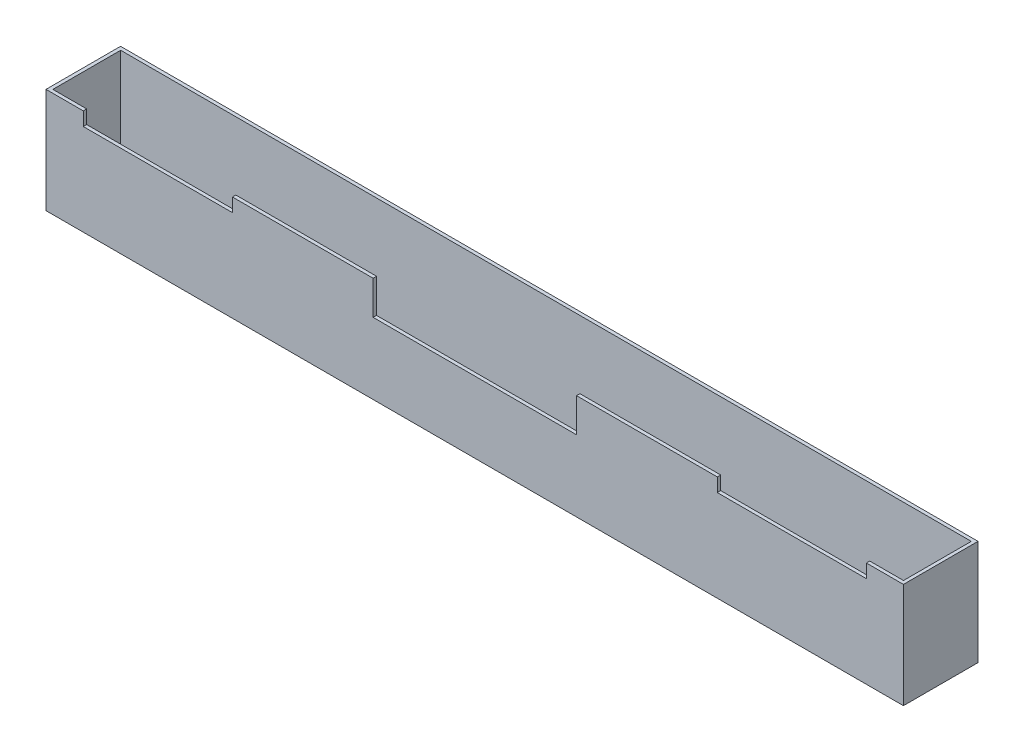
from build123d import *

# Parameters (mm, degrees)
BOSS_EXTRUDE1_DEPTH = 69.85
SKETCH3_W           = 796.798
SKETCH3_H           = 63.5
CUT_EXTRUDE1_DEPTH  = 95.25
CUT_EXTRUDE3_DEPTH  = 3.175


with BuildPart() as part:
    # Sketch2 → Boss-Extrude1 (new body)
    with BuildSketch(Plane.XY):
        Polygon((90.424, 0), (357.124, 0), (401.447, 0), (401.447, 98.425), (-401.701, 98.425), (-401.701, 0), (-366.776, 0), (-227.076, 0), (-100.076, 0), align=None)
    extrude(amount=BOSS_EXTRUDE1_DEPTH)

    # Sketch3 → Cut-Extrude1 (cut)
    with BuildSketch(Plane(origin=(0, 98.425, 0), x_dir=(1, 0, 0), z_dir=(0, 1, 0))):
        with Locations((-0.0635, -34.925)):
            Rectangle(SKETCH3_W, SKETCH3_H)
    extrude(amount=-CUT_EXTRUDE1_DEPTH, mode=Mode.SUBTRACT)

    # Sketch4 → Cut-Extrude3 (cut)
    with BuildSketch(Plane.XY.offset(69.85)):
        Polygon((-366.776, 98.425), (-366.776, 85.725), (-227.076, 85.725), (-227.076, 189.981198682), (-227.076, 207.999074197), (-95.25, 207.999074197), (-95.25, 98.425), (-95.25, 66.675), (95.25, 66.675), (95.25, 98.425), (95.25, 207.999074197), (227.076, 207.999074197), (227.076, 98.425), (227.076, 85.725), (366.776, 85.725), (366.776, 98.425), (366.776, 207.999074197), (366.776, 225.818081793), (-366.776, 225.818081793), (-366.776, 207.999074197), align=None)
    extrude(amount=-CUT_EXTRUDE3_DEPTH, mode=Mode.SUBTRACT)


solid = part.part
